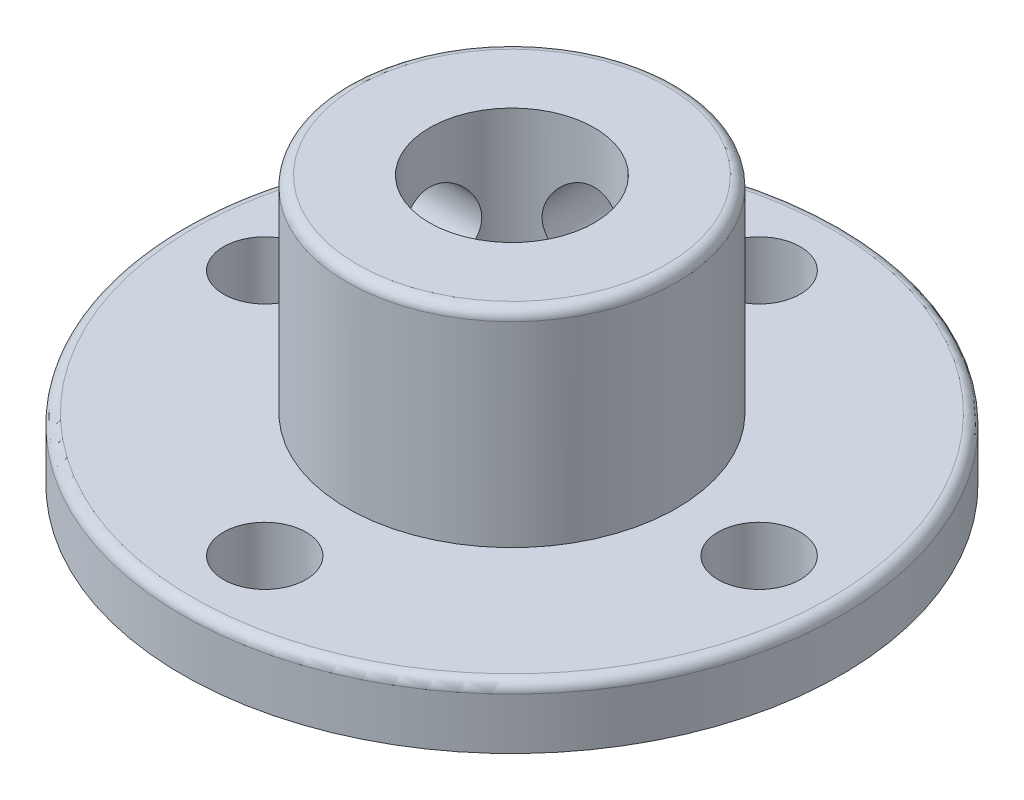
from build123d import *

# Parameters (mm, degrees)
SKETCH1_R               = 8
SKETCH1_R_2             = 4
BOSS_EXTRUDE1_DEPTH     = 13
CUT_EXTRUDE1_REACH      = 19.234
CUT_EXTRUDE1_END_RADIUS = 8
SKETCH2_R               = 2
CUT_EXTRUDE2_REACH      = 19.234
CUT_EXTRUDE2_END_RADIUS = 8
SKETCH3_R               = 2
SKETCH4_R               = 16
SKETCH4_R_2             = 4
BOSS_EXTRUDE2_DEPTH     = 3
CUT_EXTRUDE3_REACH      = 26.739
SKETCH5_R               = 2
FILLET1_R               = 0.5


with BuildPart() as part:
    # Sketch1 → Boss-Extrude1 (new body)
    with BuildSketch(Plane(origin=(0, 0, 0), x_dir=(1, 0, 0), z_dir=(0, 1, 0))):
        with Locations(Location((0, 0, 0), (0, 0, 90))):
            Circle(SKETCH1_R)
        with Locations(Location((0, 0, 0), (0, 0, 90))):
            Circle(SKETCH1_R_2, mode=Mode.SUBTRACT)
    extrude(amount=BOSS_EXTRUDE1_DEPTH)

    # Cut-Extrude1: up to this cylinder (the profile starts inside it)
    cut_extrude1_end = Plane(origin=(0, 8.5, 0), z_dir=(0, -1, 0)) * Cylinder(CUT_EXTRUDE1_END_RADIUS, 55.468, mode=Mode.PRIVATE)
    # Sketch2 → Cut-Extrude1 (cut, up to the surface)
    with BuildSketch(Plane.XY, mode=Mode.PRIVATE) as cut_extrude1_sk1:
        with Locations((0, 8.5)):
            Circle(SKETCH2_R)
    cut_extrude1_tool1 = extrude(cut_extrude1_sk1.sketch, amount=-CUT_EXTRUDE1_REACH, mode=Mode.PRIVATE) & cut_extrude1_end
    add(cut_extrude1_tool1.solids().sort_by_distance((0, 8.5, 0))[0], mode=Mode.SUBTRACT)

    # Cut-Extrude2: up to this cylinder (the profile starts inside it)
    cut_extrude2_end = Plane(origin=(0, 8.5, 0), z_dir=(0, -1, 0)) * Cylinder(CUT_EXTRUDE2_END_RADIUS, 55.468, mode=Mode.PRIVATE)
    # Sketch3 → Cut-Extrude2 (cut, up to the surface)
    with BuildSketch(Plane(origin=(0, 0, 0), x_dir=(0, 0, -1), z_dir=(1, 0, 0)), mode=Mode.PRIVATE) as cut_extrude2_sk1:
        with Locations((0, 8.5)):
            Circle(SKETCH3_R)
    cut_extrude2_tool1 = extrude(cut_extrude2_sk1.sketch, amount=-CUT_EXTRUDE2_REACH, mode=Mode.PRIVATE) & cut_extrude2_end
    add(cut_extrude2_tool1.solids().sort_by_distance((0, 8.5, 0))[0], mode=Mode.SUBTRACT)

    # Sketch4 → Boss-Extrude2 (add)
    with BuildSketch(Plane.XZ):
        with Locations(Location((0, 0, 0), (0, 0, 270))):
            Circle(SKETCH4_R)
        with Locations(Location((0, 0, 0), (0, 0, 90))):
            Circle(SKETCH4_R_2, mode=Mode.SUBTRACT)
    extrude(amount=-BOSS_EXTRUDE2_DEPTH)

    # Sketch5 → Cut-Extrude3 (cut, up to next)
    with BuildSketch(Plane(origin=(0, 3, 0), x_dir=(1, 0, 0), z_dir=(0, 1, 0)), mode=Mode.PRIVATE) as cut_extrude3_sk1:
        with Locations(Location((-12, 0, 0), (0, 0, 270))):
            Circle(SKETCH5_R)
    cut_extrude3_tool1 = extrude(cut_extrude3_sk1.sketch, amount=-CUT_EXTRUDE3_REACH, mode=Mode.PRIVATE) & part.part
    # Sketch5 → Cut-Extrude3 (cut, up to next)
    with BuildSketch(Plane(origin=(0, 3, 0), x_dir=(1, 0, 0), z_dir=(0, 1, 0)), mode=Mode.PRIVATE) as cut_extrude3_sk2:
        with Locations(Location((0, 12, 0), (0, 0, 270))):
            Circle(SKETCH5_R)
    cut_extrude3_tool2 = extrude(cut_extrude3_sk2.sketch, amount=-CUT_EXTRUDE3_REACH, mode=Mode.PRIVATE) & part.part
    # Sketch5 → Cut-Extrude3 (cut, up to next)
    with BuildSketch(Plane(origin=(0, 3, 0), x_dir=(1, 0, 0), z_dir=(0, 1, 0)), mode=Mode.PRIVATE) as cut_extrude3_sk3:
        with Locations(Location((12, 0, 0), (0, 0, 270))):
            Circle(SKETCH5_R)
    cut_extrude3_tool3 = extrude(cut_extrude3_sk3.sketch, amount=-CUT_EXTRUDE3_REACH, mode=Mode.PRIVATE) & part.part
    # Sketch5 → Cut-Extrude3 (cut, up to next)
    with BuildSketch(Plane(origin=(0, 3, 0), x_dir=(1, 0, 0), z_dir=(0, 1, 0)), mode=Mode.PRIVATE) as cut_extrude3_sk4:
        with Locations(Location((0, -12, 0), (0, 0, 270))):
            Circle(SKETCH5_R)
    cut_extrude3_tool4 = extrude(cut_extrude3_sk4.sketch, amount=-CUT_EXTRUDE3_REACH, mode=Mode.PRIVATE) & part.part
    add(cut_extrude3_tool1.solids().sort_by_distance((-12, 3, 0))[0], mode=Mode.SUBTRACT)
    add(cut_extrude3_tool2.solids().sort_by_distance((0, 3, -12))[0], mode=Mode.SUBTRACT)
    add(cut_extrude3_tool3.solids().sort_by_distance((12, 3, 0))[0], mode=Mode.SUBTRACT)
    add(cut_extrude3_tool4.solids().sort_by_distance((0, 3, 12))[0], mode=Mode.SUBTRACT)

    # Fillet1
    fillet1_edges = [part.edges().sort_by_distance(p)[0] for p in [
        (0, 3, 16),
        (0, 13, 8),
    ]]
    fillet(fillet1_edges, radius=FILLET1_R)


solid = part.part
